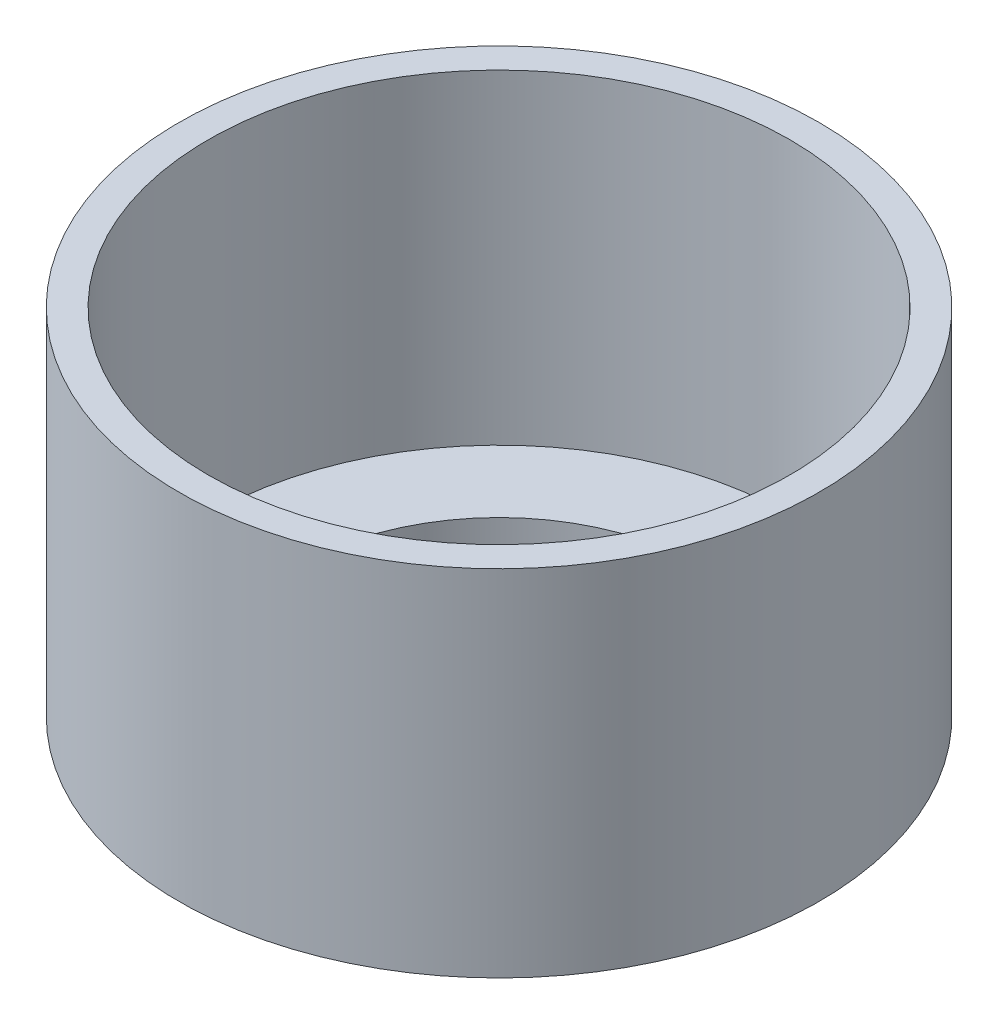
from build123d import *

# Parameters (mm, degrees)
SKETCH1_R           = 68.84196009
BOSS_EXTRUDE1_DEPTH = 76.2
SKETCH2_R           = 62.49196009
CUT_EXTRUDE1_DEPTH  = 69.85
SKETCH3_R           = 43.44196009
CUT_EXTRUDE2_DEPTH  = 120.822591517


with BuildPart() as part:
    # Sketch1 → Boss-Extrude1 (new body)
    with BuildSketch(Plane(origin=(0, 0, 0), x_dir=(1, 0, 0), z_dir=(0, 1, 0))):
        with Locations(Location((0, 0, 0), (0, 0, 90))):
            Circle(SKETCH1_R)
    extrude(amount=BOSS_EXTRUDE1_DEPTH)

    # Sketch2 → Cut-Extrude1 (cut)
    with BuildSketch(Plane(origin=(0, 76.2, 0), x_dir=(1, 0, 0), z_dir=(0, 1, 0))):
        with Locations(Location((0, 0, 0), (0, 0, 270))):
            Circle(SKETCH2_R)
    extrude(amount=-CUT_EXTRUDE1_DEPTH, mode=Mode.SUBTRACT)

    # Sketch3 → Cut-Extrude2 (cut, through all)
    with BuildSketch(Plane(origin=(0, 6.35, 0), x_dir=(1, 0, 0), z_dir=(0, 1, 0))):
        with Locations(Location((0, 0, 0), (0, 0, 270))):
            Circle(SKETCH3_R)
    extrude(amount=-CUT_EXTRUDE2_DEPTH, mode=Mode.SUBTRACT)


solid = part.part
